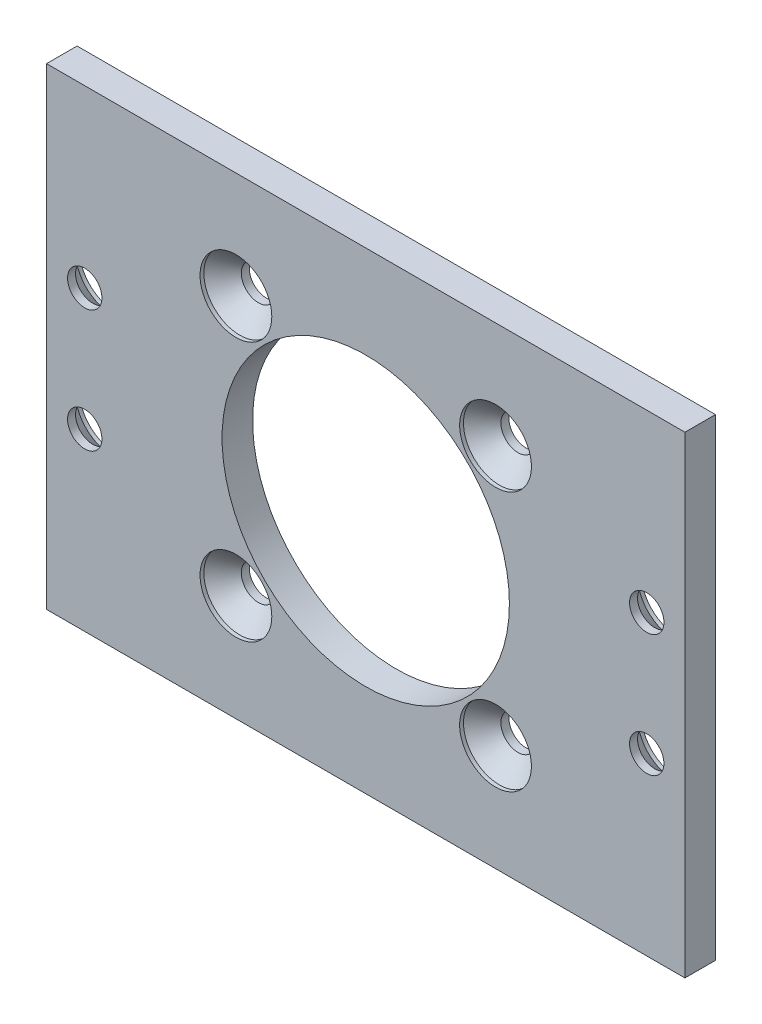
from build123d import *

# Parameters (mm, degrees)
ESQUISSE1_W                                 = 83.6
ESQUISSE1_H                                 = 61.9
ESQUISSE1_R                                 = 18.813799135
BOSS_EXTRU_1_DEPTH                          = 4
FRAISAGE_POUR_VIS_T_TE_FRAIS_E_M41_AT_COUNT = 2
FRAISAGE_POUR_VIS_T_TE_FRAIS_E_M41_AT_PITCH = 34
FRAISAGE_POUR_VIS_T_TE_FRAIS_E_M41_2_COUNT  = 2
FRAISAGE_POUR_VIS_T_TE_FRAIS_E_M41_2_PITCH  = 48.083261121
FRAISAGE_POUR_VIS_T_TE_FRAIS_E_M41_3_COUNT  = 2
FRAISAGE_POUR_VIS_T_TE_FRAIS_E_M41_3_PITCH  = 34
FRAISAGE_POUR_VIS_T_TE_FRAIS_E_M42_AT_COUNT = 2
FRAISAGE_POUR_VIS_T_TE_FRAIS_E_M42_AT_PITCH = 16
FRAISAGE_POUR_VIS_T_TE_FRAIS_E_M42_2_COUNT  = 2
FRAISAGE_POUR_VIS_T_TE_FRAIS_E_M42_2_PITCH  = 75.319054694
FRAISAGE_POUR_VIS_T_TE_FRAIS_E_M42_3_COUNT  = 2
FRAISAGE_POUR_VIS_T_TE_FRAIS_E_M42_3_PITCH  = 73.6


with BuildPart() as part:
    # Esquisse1 → Boss.-Extru.1 (new body)
    with BuildSketch(Plane.XY):
        Rectangle(ESQUISSE1_W, ESQUISSE1_H)
        Circle(ESQUISSE1_R, mode=Mode.SUBTRACT)
    extrude(amount=BOSS_EXTRU_1_DEPTH)

    # Esquisse4 → Fraisage pour vis à tête fraisée M41 (revolve, cut)
    with BuildSketch(Plane(origin=(-17, 17, 4), x_dir=(0, -1, 0), z_dir=(1, 0, 0))):
        Polygon((0, 0), (0, 12.851936393), (2.25, 11.5), (2.25, 2.95), (4.7, 0.5), (4.7, 0), align=None)
    fraisage_pour_vis_t_te_frais_e_m41 = revolve(axis=Axis((-17, 17, 10.35), (0, 0, -1)), mode=Mode.SUBTRACT)

    # Fraisage pour vis à tête fraisée M41 at: Fraisage pour vis à tête fraisée M41 ×2
    with Locations(*[(i * FRAISAGE_POUR_VIS_T_TE_FRAIS_E_M41_AT_PITCH, 0, 0) for i in range(1, FRAISAGE_POUR_VIS_T_TE_FRAIS_E_M41_AT_COUNT)]):
        add(fraisage_pour_vis_t_te_frais_e_m41, mode=Mode.SUBTRACT)

    # Fraisage pour vis _ t_te frais_e M41 2: Fraisage pour vis à tête fraisée M41 ×2
    with Locations(*[Vector(0.7071067811865476, -0.7071067811865475, 0) * (i * FRAISAGE_POUR_VIS_T_TE_FRAIS_E_M41_2_PITCH) for i in range(1, FRAISAGE_POUR_VIS_T_TE_FRAIS_E_M41_2_COUNT)]):
        add(fraisage_pour_vis_t_te_frais_e_m41, mode=Mode.SUBTRACT)

    # Fraisage pour vis _ t_te frais_e M41 3: Fraisage pour vis à tête fraisée M41 ×2
    with Locations(*[(0, -i * FRAISAGE_POUR_VIS_T_TE_FRAIS_E_M41_3_PITCH, 0) for i in range(1, FRAISAGE_POUR_VIS_T_TE_FRAIS_E_M41_3_COUNT)]):
        add(fraisage_pour_vis_t_te_frais_e_m41, mode=Mode.SUBTRACT)

    # Esquisse8 → Fraisage pour vis à tête fraisée M42 (revolve, cut)
    with BuildSketch(Plane(origin=(-36.8, 8, 0), x_dir=(0, 1, 0), z_dir=(1, 0, 0))):
        Polygon((0, 0), (0, 12.851936393), (2.25, 11.5), (2.25, 2.95), (4.7, 0.5), (4.7, 0), align=None)
    fraisage_pour_vis_t_te_frais_e_m42 = revolve(axis=Axis((-36.8, 8, -6.35), (0, 0, 1)), mode=Mode.SUBTRACT)

    # Fraisage pour vis à tête fraisée M42 at: Fraisage pour vis à tête fraisée M42 ×2
    with Locations(*[(0, -i * FRAISAGE_POUR_VIS_T_TE_FRAIS_E_M42_AT_PITCH, 0) for i in range(1, FRAISAGE_POUR_VIS_T_TE_FRAIS_E_M42_AT_COUNT)]):
        add(fraisage_pour_vis_t_te_frais_e_m42, mode=Mode.SUBTRACT)

    # Fraisage pour vis _ t_te frais_e M42 2: Fraisage pour vis à tête fraisée M42 ×2
    with Locations(*[Vector(0.9771763639228009, -0.21242964433104397, 0) * (i * FRAISAGE_POUR_VIS_T_TE_FRAIS_E_M42_2_PITCH) for i in range(1, FRAISAGE_POUR_VIS_T_TE_FRAIS_E_M42_2_COUNT)]):
        add(fraisage_pour_vis_t_te_frais_e_m42, mode=Mode.SUBTRACT)

    # Fraisage pour vis _ t_te frais_e M42 3: Fraisage pour vis à tête fraisée M42 ×2
    with Locations(*[(i * FRAISAGE_POUR_VIS_T_TE_FRAIS_E_M42_3_PITCH, 0, 0) for i in range(1, FRAISAGE_POUR_VIS_T_TE_FRAIS_E_M42_3_COUNT)]):
        add(fraisage_pour_vis_t_te_frais_e_m42, mode=Mode.SUBTRACT)


solid = part.part
